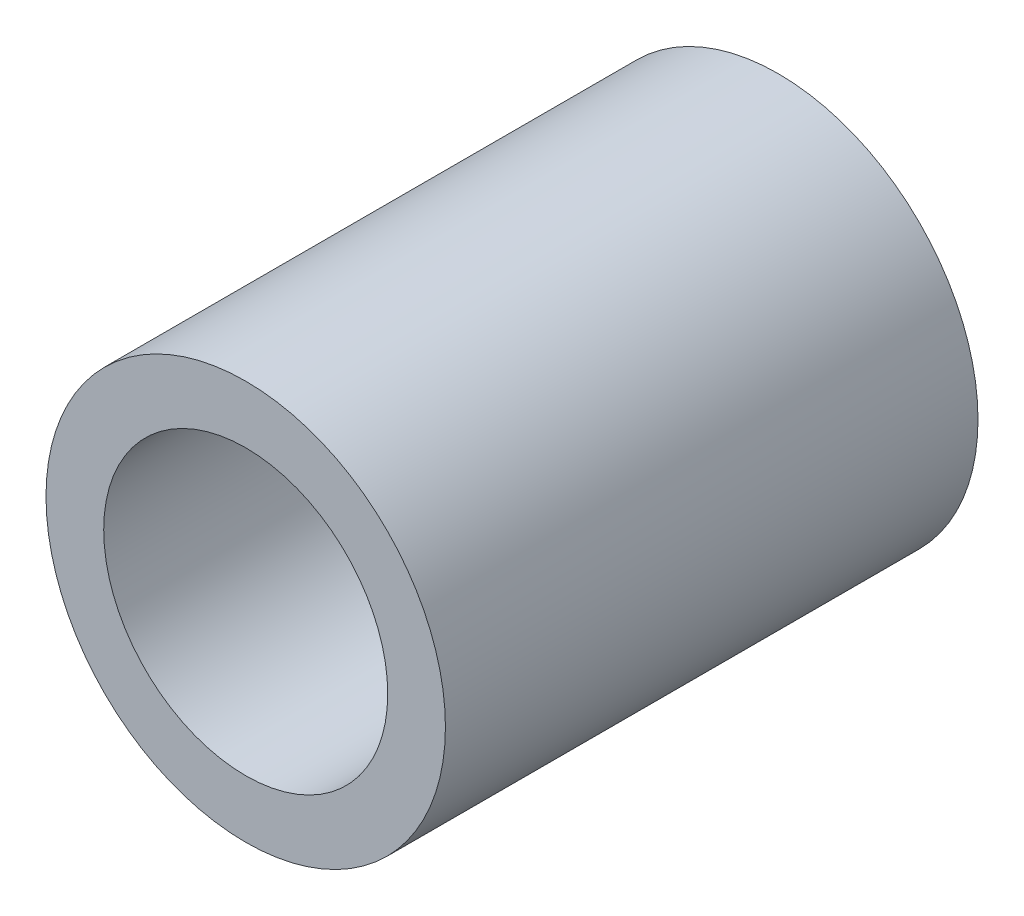
from build123d import *

# Parameters (mm, degrees)
SKETCH1_R      = 2.25
SKETCH1_R_2    = 1.6
EXTRUDE1_DEPTH = 3


with BuildPart() as part:
    # Sketch1 → Extrude1 (new, symmetric)
    with BuildSketch(Plane.XY):
        Circle(SKETCH1_R)
        Circle(SKETCH1_R_2, mode=Mode.SUBTRACT)
    extrude(amount=EXTRUDE1_DEPTH, both=True)


solid = part.part
